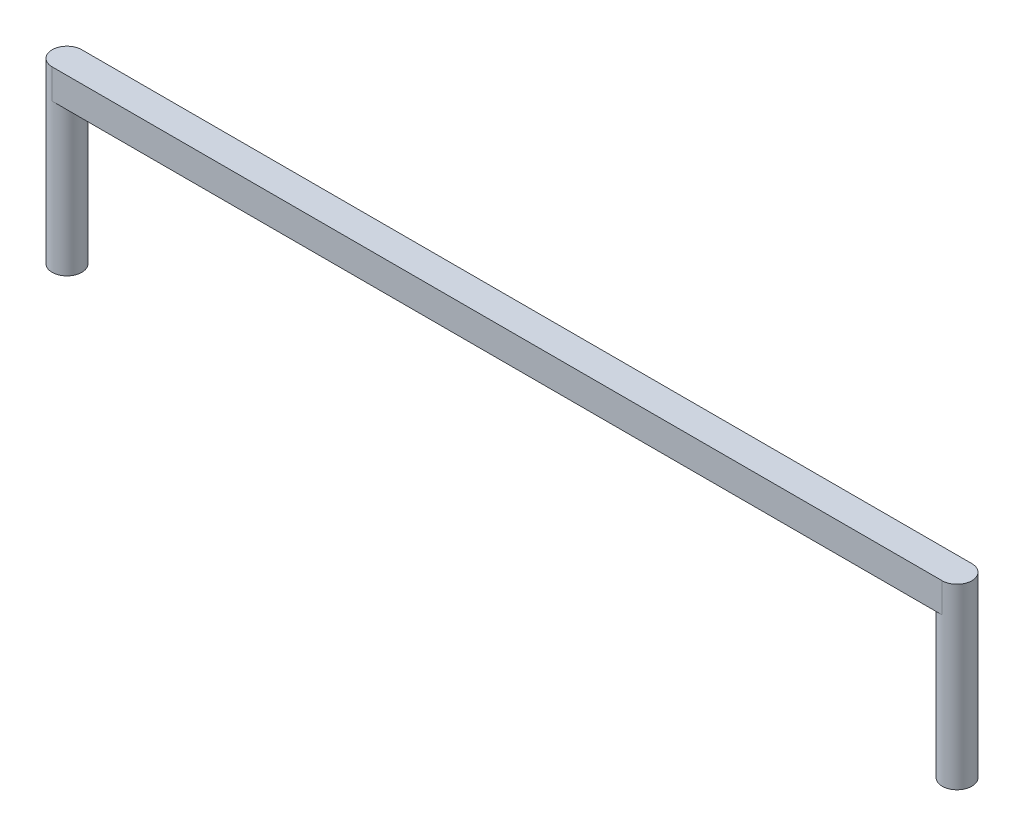
from build123d import *
from build123d.topology import SkipClean

# Parameters (mm, degrees)
SALIENTE_EXTRUIR1_DEPTH = 2
SALIENTE_EXTRUIR2_START = -12
CROQUIS2_R              = 1
SALIENTE_EXTRUIR2_DEPTH = 12


with BuildPart() as part:
    # Croquis1 → Saliente-Extruir1 (new body)
    with BuildSketch(Plane(origin=(0, -13.655018192, 0), x_dir=(1, 0, 0), z_dir=(0, 1, 0))):
        with BuildLine():
            Line((-15.39391873, -33.464706181), (44.60608127, -33.464706181))
            ThreePointArc((44.60608127, -33.464706181), (45.60608127, -34.464706181), (44.60608127, -35.464706181))
            Line((44.60608127, -35.464706181), (-15.39391873, -35.464706181))
            ThreePointArc((-15.39391873, -35.464706181), (-16.39391873, -34.464706181), (-15.39391873, -33.464706181))
        make_face()
    extrude(amount=SALIENTE_EXTRUIR1_DEPTH)

    # Croquis2 → Saliente-Extruir2 (add)
    with SkipClean():  # the faces are left unmerged after this step: merging them gives an invalid solid
        with BuildSketch(Plane(origin=(0, -11.655018192, 0), x_dir=(1, 0, 0), z_dir=(0, 1, 0)).offset(SALIENTE_EXTRUIR2_START)):
            with Locations(Location((-15.39391873, -34.464706181, 0), (0, 0, 270))):
                Circle(CROQUIS2_R)
            with Locations(Location((44.60608127, -34.464706181, 0), (0, 0, 270))):
                Circle(CROQUIS2_R)
        extrude(amount=SALIENTE_EXTRUIR2_DEPTH)


solid = part.part
